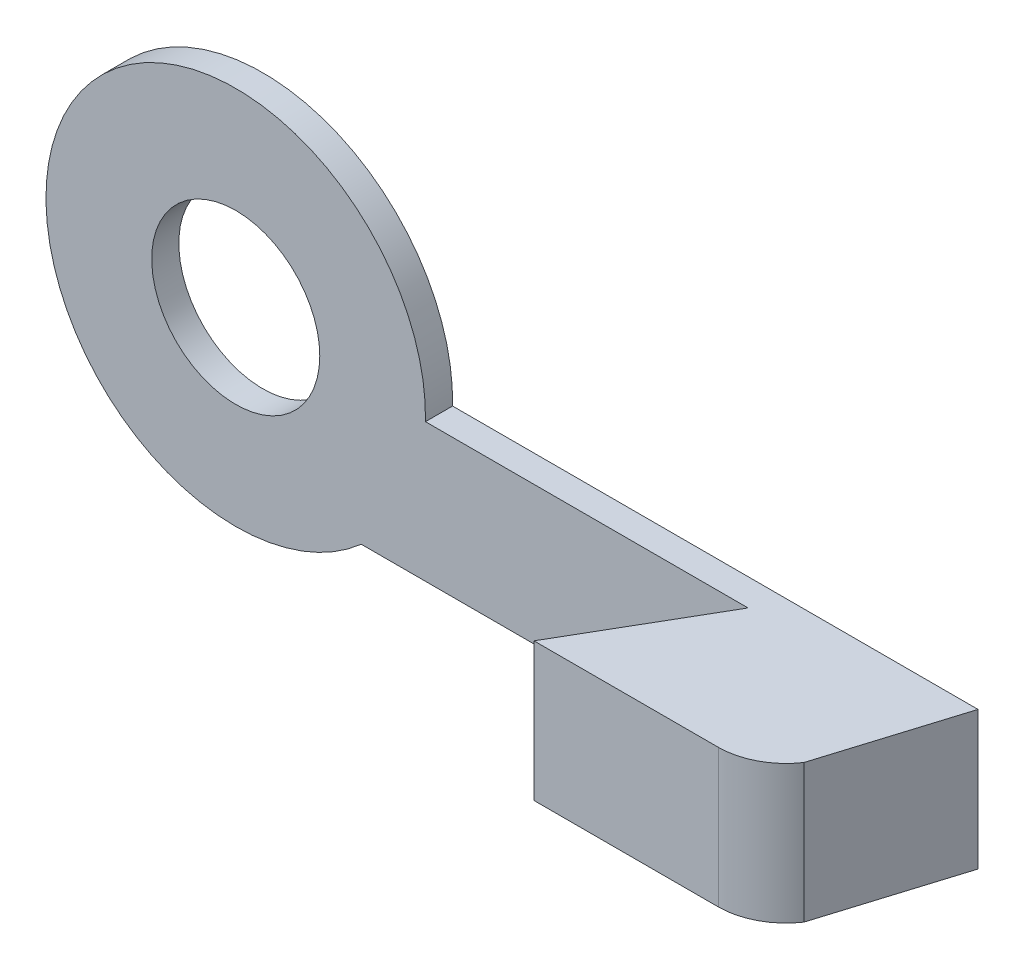
from build123d import *

# Parameters (mm, degrees)
BOSS_EXTRUDE1_DEPTH     = 5.1
SKETCH4_W               = 1
SKETCH4_H               = 5.1
BOSS_EXTRUDE2_DEPTH     = 18.9
SKETCH5_R               = 7
BOSS_EXTRUDE3_DEPTH     = 1
CUT_EXTRUDE1_DEPTH      = 33.605252644
CUT_EXTRUDE1_DEPTH_BACK = 33.605252644
SKETCH6_R               = 3.1
BOSS_EXTRUDE4_DEPTH     = 5.1
CUT_EXTRUDE2_DEPTH      = 10
BOSS_EXTRUDE5_DEPTH     = 5.1


with BuildPart() as part:
    # Sketch3 → Boss-Extrude1 (new body)
    with BuildSketch(Plane(origin=(0, 0, 0), x_dir=(1, 0, 0), z_dir=(0, 1, 0))):
        with BuildLine():
            Line((0, -2.5), (-3.9, -2.5))
            Line((-3.9, -2.5), (-3.9, 3.5))
            Line((-3.9, 3.5), (-1, 3.5))
            ThreePointArc((-1, 3.5), (1.474873734, 2.474873734), (2.5, 0))
            ThreePointArc((2.5, 0), (1.767766953, -1.767766953), (0, -2.5))
        make_face()
    extrude(amount=BOSS_EXTRUDE1_DEPTH)

    # Sketch4 → Boss-Extrude2 (add)
    with BuildSketch(Plane.ZY.offset(3.9)):
        with Locations((-3, 2.55)):
            Rectangle(SKETCH4_W, SKETCH4_H)
    extrude(amount=BOSS_EXTRUDE2_DEPTH)

    # Sketch5 → Boss-Extrude3 (add)
    with BuildSketch(Plane(origin=(0, 0, -3.5), x_dir=(-1, 0, 0), z_dir=(0, 0, -1))):
        with Locations((22.8, 5.25)):
            Circle(SKETCH5_R)
    extrude(amount=-BOSS_EXTRUDE3_DEPTH)

    # Sketch6 → Cut-Extrude1 (cut, two sides: drawn at the far end of the back side and taken through both)
    with BuildSketch(Plane.XY.offset(-2.5).offset(-CUT_EXTRUDE1_DEPTH_BACK)):
        with Locations((-22.8, 5.25)):
            Circle(SKETCH6_R)
    extrude(amount=CUT_EXTRUDE1_DEPTH + CUT_EXTRUDE1_DEPTH_BACK, mode=Mode.SUBTRACT)

    # Sketch7 → Boss-Extrude4 (add)
    with BuildSketch(Plane.XZ):
        Polygon((-3.9, -2.5), (-3.9, 2.5), (-6.8, 2.5), align=None)
    extrude(amount=-BOSS_EXTRUDE4_DEPTH)

    # Sketch8 → Cut-Extrude2 (cut)
    with BuildSketch(Plane(origin=(0, 5.1, 0), x_dir=(1, 0, 0), z_dir=(0, 1, 0))):
        Polygon((2.5, 0), (0.957021589, -5), (5.957021589, -5), (5.957021589, 0), align=None)
    extrude(amount=-CUT_EXTRUDE2_DEPTH, mode=Mode.SUBTRACT)

    # Sketch9 → Boss-Extrude5 (add)
    with BuildSketch(Plane(origin=(0, 0, 0), x_dir=(1, 0, 0), z_dir=(0, 1, 0))):
        Polygon((2.5, 0), (3.580084888, 3.5), (-1, 3.5), align=None)
    extrude(amount=BOSS_EXTRUDE5_DEPTH)


solid = part.part
